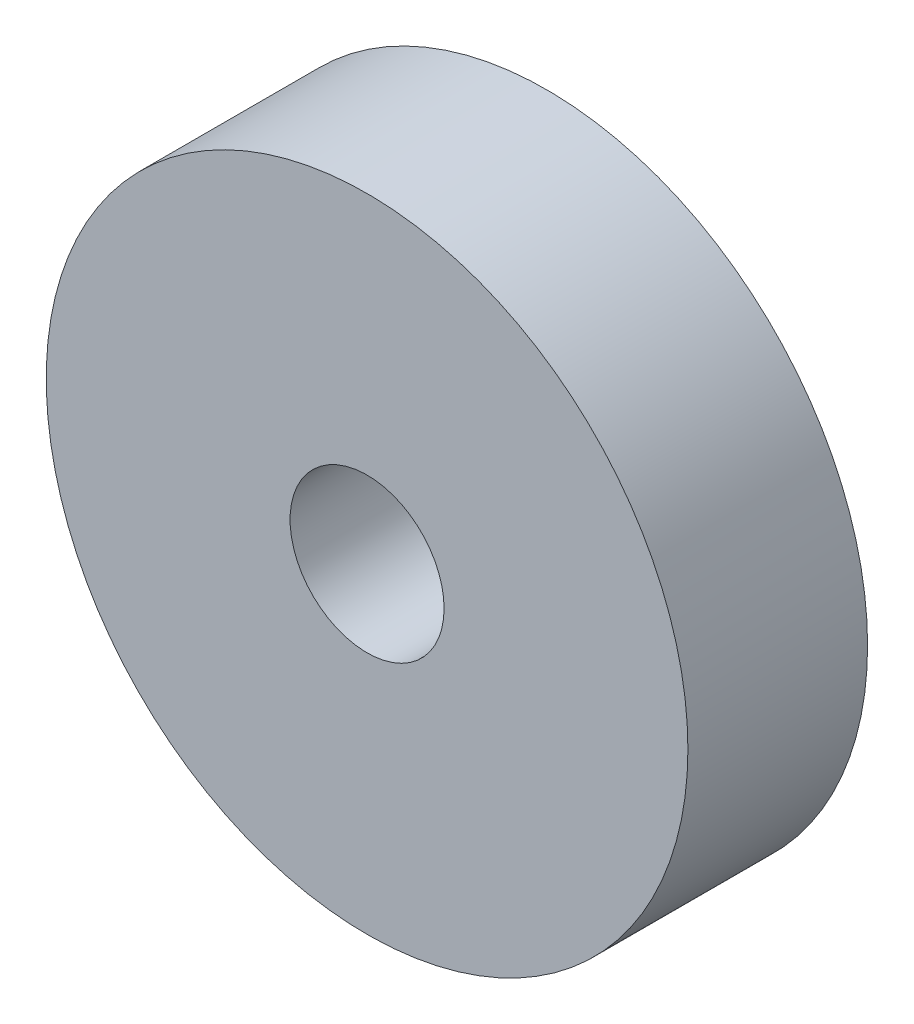
from build123d import *

# Parameters (mm, degrees)
SKETCH2_R           = 12.5
BOSS_EXTRUDE1_DEPTH = 7
SKETCH3_R           = 3
CUT_EXTRUDE1_DEPTH  = 7


with BuildPart() as part:
    # Sketch2 → Boss-Extrude1 (new body)
    with BuildSketch(Plane.XY):
        Circle(SKETCH2_R)
    extrude(amount=BOSS_EXTRUDE1_DEPTH)

    # Sketch3 → Cut-Extrude1 (cut)
    with BuildSketch(Plane.XY.offset(7)):
        Circle(SKETCH3_R)
    extrude(amount=-CUT_EXTRUDE1_DEPTH, mode=Mode.SUBTRACT)


solid = part.part
